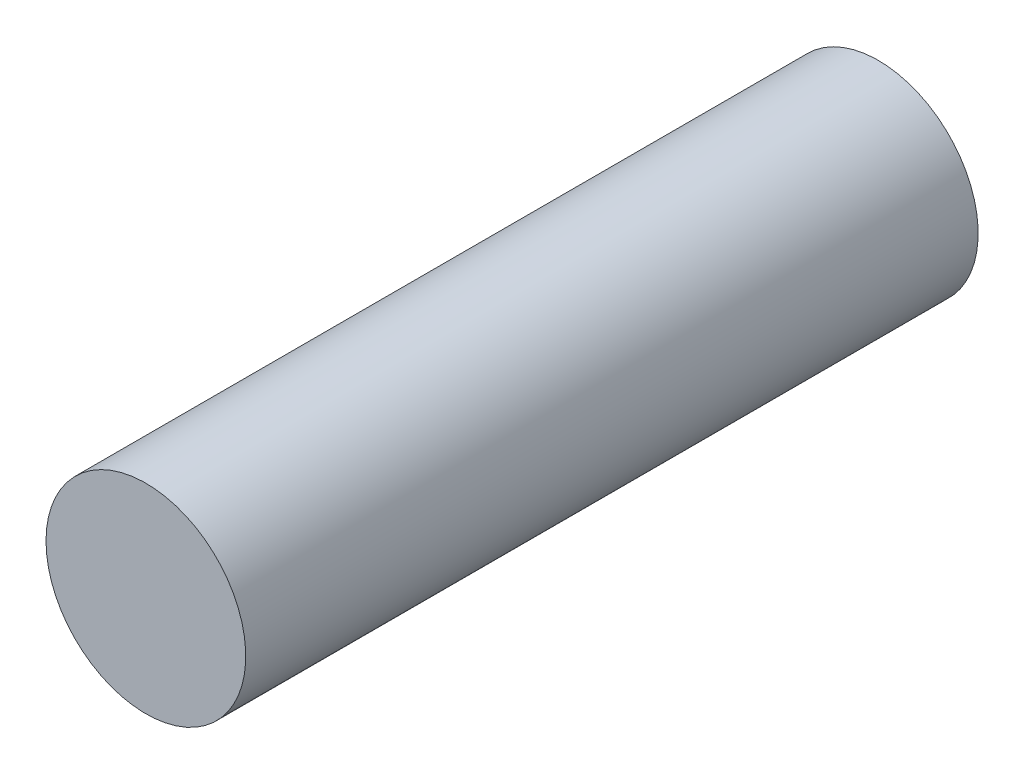
from build123d import *

# Parameters (mm, degrees)
SKETCH1_W = 1.5
SKETCH1_H = 11


with BuildPart() as part:
    # Sketch1 → Revolve1 (revolve)
    with BuildSketch(Plane(origin=(0, 0, 0), x_dir=(1, 0, 0), z_dir=(0, 1, 0))):
        with Locations((-0.75, -5.5)):
            Rectangle(SKETCH1_W, SKETCH1_H)
    revolve(axis=Axis((0, 0, 0), (0, 0, 1)))


solid = part.part
